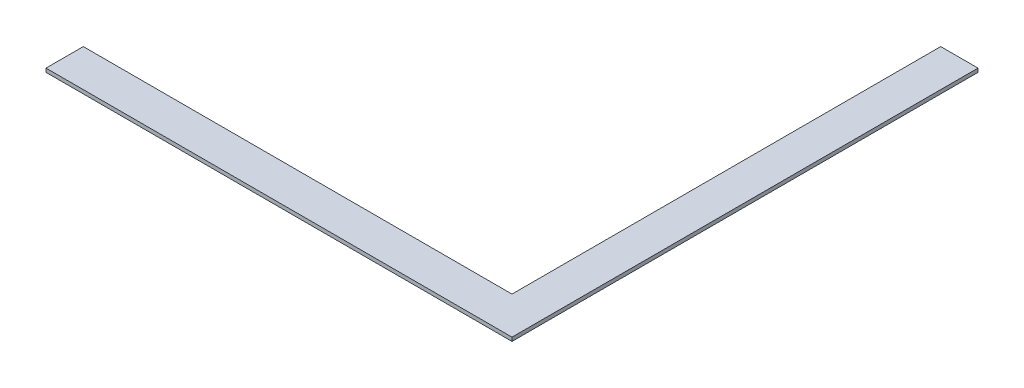
from build123d import *

# Parameters (mm, degrees)
BOSS_EXTRUDE1_DEPTH = 2


with BuildPart() as part:
    # Sketch1 → Boss-Extrude1 (new body)
    with BuildSketch(Plane(origin=(0, 0, 0), x_dir=(1, 0, 0), z_dir=(0, 1, 0))):
        Polygon((0, 0), (250, 0), (250, 250), (230, 250), (230, 20), (0, 20), align=None)
    extrude(amount=BOSS_EXTRUDE1_DEPTH)


solid = part.part
